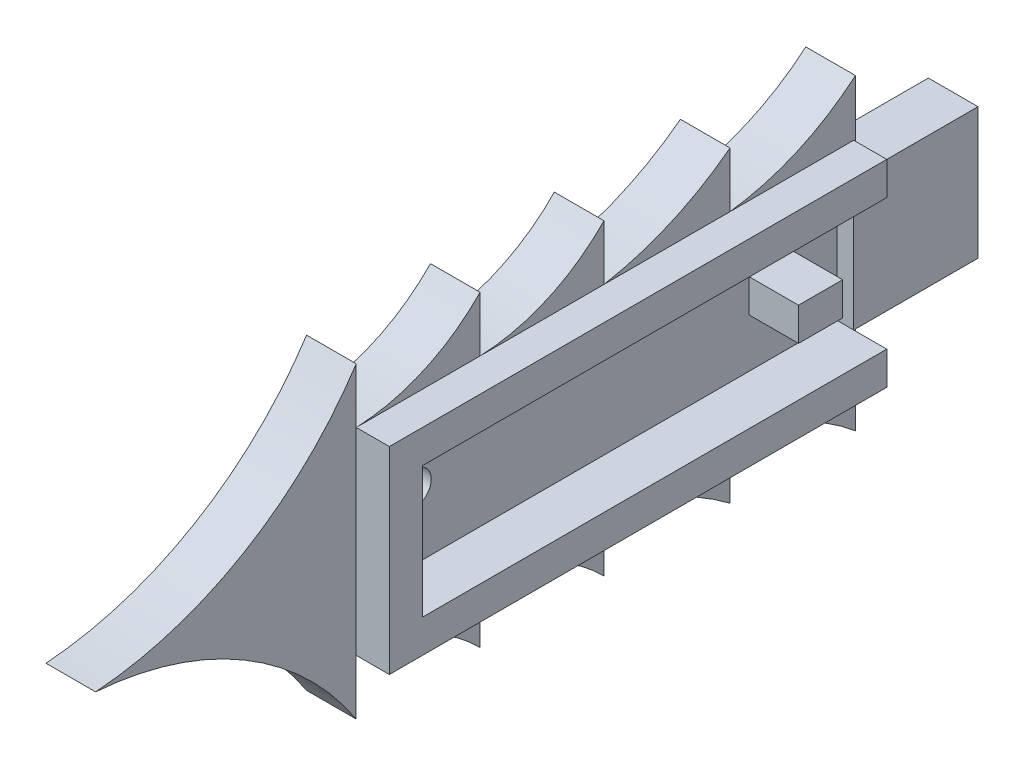
from build123d import *

# Parameters (mm, degrees)
SKETCH1_W               = 3
SKETCH1_H               = 42.1
SKETCH1_H_2             = 4
BOSS_EXTRUDE1_DEPTH     = 12
SKETCH3_W               = 45.1
SKETCH3_H               = 17.9
SKETCH3_R               = 1.5
BOSS_EXTRUDE2_DEPTH     = 3
SKETCH5_W               = 17.9
SKETCH5_H               = 45.1
BOSS_EXTRUDE4_DEPTH     = 4.5
CUT_EXTRUDE4_DEPTH      = 54.638254019
CUT_EXTRUDE5_DEPTH      = 54.638254019
CUT_EXTRUDE5_DEPTH_BACK = 7.5
SKETCH7_W               = 17.9
SKETCH7_H               = 45.1


with BuildPart() as part:
    # Sketch1 → Boss-Extrude1 (new body)
    with BuildSketch(Plane.YZ):
        Polygon((-5.95, 3.8), (5.95, 3.8), (8.95, 3.8), (8.95, 6.8), (-8.95, 6.8), (-8.95, 3.8), align=None)
        with Locations((-7.45, -17.25)):
            Rectangle(SKETCH1_W, SKETCH1_H)
        with Locations((7.45, -17.25)):
            Rectangle(SKETCH1_W, SKETCH1_H)
        with Locations((0, -32.3)):
            Rectangle(SKETCH1_W, SKETCH1_H_2)
    extrude(amount=BOSS_EXTRUDE1_DEPTH)

    # Sketch3 → Boss-Extrude2 (add)
    with BuildSketch(Plane.ZY):
        with Locations((-15.75, 0)):
            Rectangle(SKETCH3_W, SKETCH3_H)
        Circle(SKETCH3_R, mode=Mode.SUBTRACT)
    extrude(amount=BOSS_EXTRUDE2_DEPTH)

    # Sketch5 → Boss-Extrude4 (add)
    with BuildSketch(Plane(origin=(-3, 0, 0), x_dir=(0, -1, 0), z_dir=(-1, 0, 0))):
        Polygon((-13.95, 21.583539772), (-13.95, -49.572772711), (13.95, -49.572772711), (13.95, 20.927227289), (13.95, 30.427227289), (-13.95, 30.427227289), align=None)
        with Locations((0, -15.75)):
            Rectangle(SKETCH5_W, SKETCH5_H, mode=Mode.SUBTRACT)
    extrude(amount=-BOSS_EXTRUDE4_DEPTH)

    # Sketch6 → Cut-Extrude4 (cut, symmetric)
    with BuildSketch(Plane(origin=(-3, 0, 0), x_dir=(0, -1, 0), z_dir=(-1, 0, 0))):
        with BuildLine():
            Line((-8.95, -4.430558852), (-13.95, -4.430558852))
            ThreePointArc((-13.95, -4.430558852), (-10.365862707, 0.702047669), (-8.95, 6.8))
            Line((-8.95, 6.8), (-13.95, 6.8))
            ThreePointArc((-13.95, 6.8), (-4.216827043, 16.985131712), (0, 30.427227289))
            Line((0, 30.427227289), (0, 38.207310194))
            Line((0, 38.207310194), (-27.495186948, 38.207310194))
            Line((-27.495186948, 38.207310194), (-27.495186948, -49.572772711))
            Line((-27.495186948, -49.572772711), (-5.95, -49.572772711))
            Line((-5.95, -49.572772711), (-5.95, -38.463062756))
            Line((-5.95, -38.463062756), (-13.95, -38.463062756))
            ThreePointArc((-13.95, -38.463062756), (-10.621066319, -33.1423359), (-8.95, -27.092586229))
            Line((-8.95, -27.092586229), (-13.95, -27.092586229))
            ThreePointArc((-13.95, -27.092586229), (-10.764093377, -21.676860063), (-8.95, -15.661117704))
            Line((-8.95, -15.661117704), (-13.95, -15.661117704))
            ThreePointArc((-13.95, -15.661117704), (-10.365862707, -10.528511183), (-8.95, -4.430558852))
        make_face()
    cut_extrude4 = extrude(amount=CUT_EXTRUDE4_DEPTH, both=True, mode=Mode.SUBTRACT)

    # Mirror1: Cut-Extrude4 across plane
    add(cut_extrude4.mirror(Plane.ZX), mode=Mode.SUBTRACT)

    # Sketch7 → Cut-Extrude5 (cut, two sides: drawn at the far end of the back side and taken through both)
    with BuildSketch(Plane.YZ.offset(12).offset(-CUT_EXTRUDE5_DEPTH_BACK)):
        with Locations((0, -15.75)):
            Rectangle(SKETCH7_W, SKETCH7_H)
    extrude(amount=CUT_EXTRUDE5_DEPTH + CUT_EXTRUDE5_DEPTH_BACK, mode=Mode.SUBTRACT)


solid = part.part
